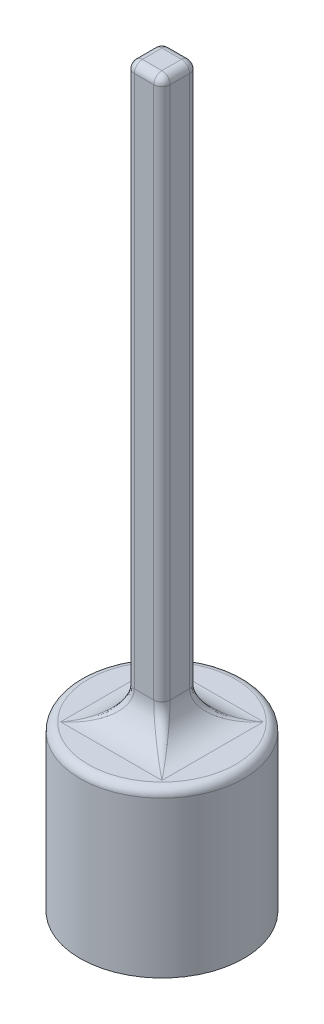
from build123d import *

# Parameters (mm, degrees)
SKETCH1_R                  = 6.35
BOSS_EXTRUDE1_DEPTH        = 12.7
SKETCH2_W                  = 2.778125
SKETCH2_H                  = 2.778125
BOSS_EXTRUDE2_DEPTH        = 44.45
FILLET1_R                  = 2.54
FILLET2_R                  = 0.635
F_10_24_TAPPED_HOLE1_D     = 3.7973
F_10_24_TAPPED_HOLE1_DEPTH = 9.525
F_10_24_TAPPED_HOLE1_TIP   = 1.140824014


with BuildPart() as part:
    # Sketch1 → Boss-Extrude1 (new body)
    with BuildSketch(Plane(origin=(0, 0, 0), x_dir=(0, 0, -1), z_dir=(0, 1, 0))):
        with Locations(Location((0, 0, 0), (0, 0, 180))):
            Circle(SKETCH1_R)
    extrude(amount=BOSS_EXTRUDE1_DEPTH)

    # Sketch2 → Boss-Extrude2 (add)
    with BuildSketch(Plane(origin=(-12.7, 12.7, 0), x_dir=(0, 0, -1), z_dir=(0, -1, 0))):
        with Locations((0, 12.7)):
            Rectangle(SKETCH2_W, SKETCH2_H)
    extrude(amount=-BOSS_EXTRUDE2_DEPTH)

    # Fillet1
    fillet1_edges = [part.edges().sort_by_distance(p)[0] for p in [
        (0, 12.7, -1.3890625),
        (-1.3890625, 12.7, 0),
        (1.3890625, 12.7, 0),
        (0, 12.7, 1.3890625),
    ]]
    fillet(fillet1_edges, radius=FILLET1_R)

    # Fillet2
    fillet2_edges = [part.edges().sort_by_distance(p)[0] for p in [
        (2.288098275, 13.301228117, -2.288098275),
        (-2.288098218, 13.301228166, -2.288098218),
        (2.288098215, 13.301228168, 2.288098215),
        (-2.288098198, 13.301228182, 2.288098198),
        (0, 12.7, -6.35),
        (1.3890625, 36.195, -1.3890625),
        (-1.3890625, 36.195, -1.3890625),
        (0, 57.15, 1.3890625),
        (-1.3890625, 36.195, 1.3890625),
        (1.3890625, 57.15, 0),
        (1.3890625, 36.195, 1.3890625),
        (0, 57.15, -1.3890625),
        (-1.3890625, 57.15, 0),
    ]]
    fillet(fillet2_edges, radius=FILLET2_R)

    # #10-24 Tapped Hole1
    with Locations(Plane(origin=(0, 0, 0), x_dir=(-1, 0, 0), z_dir=(0, -1, 0))):
        with Locations((0, 0)):
            Hole(F_10_24_TAPPED_HOLE1_D / 2, depth=F_10_24_TAPPED_HOLE1_DEPTH)
            with Locations((0, 0, -(F_10_24_TAPPED_HOLE1_DEPTH + F_10_24_TAPPED_HOLE1_TIP / 2))):  # 118° drill point
                Cone(0, F_10_24_TAPPED_HOLE1_D / 2, F_10_24_TAPPED_HOLE1_TIP, mode=Mode.SUBTRACT)


solid = part.part
